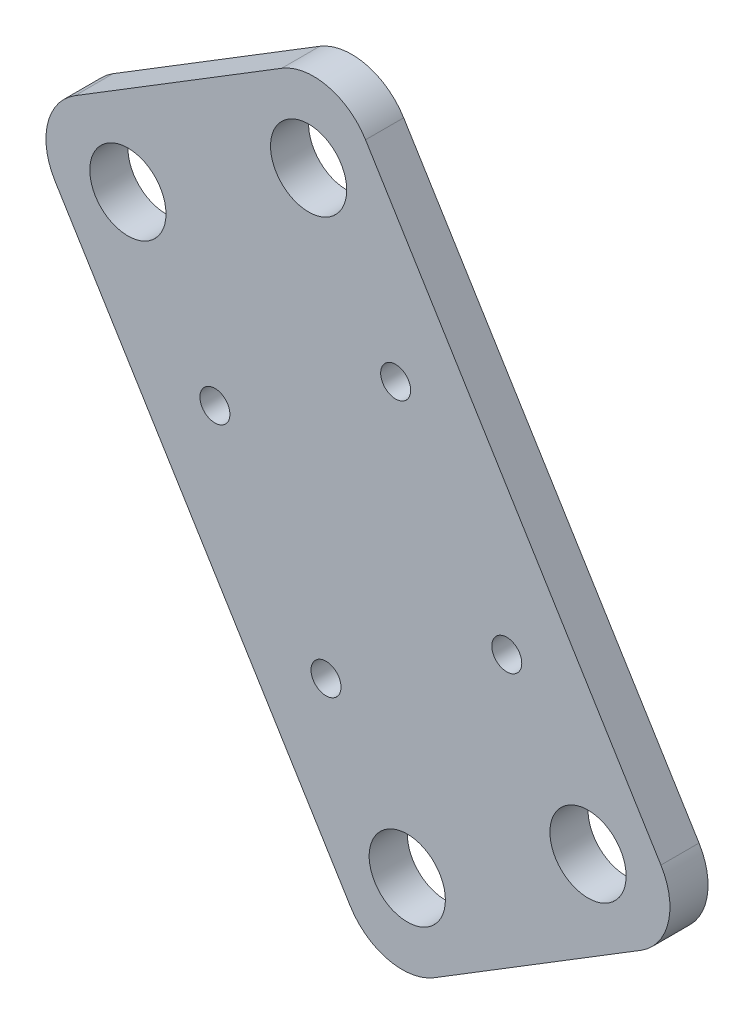
from build123d import *

# Parameters (mm, degrees)
SKETCH1_R           = 3.175
BOSS_EXTRUDE1_DEPTH = 3.175


with BuildPart() as part:
    # Sketch1 → Boss-Extrude1 (new body)
    with BuildSketch(Plane.XY):
        with BuildLine():
            Line((-86.435913995, -165.602360031), (-61.825632619, -205.632275727))
            ThreePointArc((-61.825632619, -205.632275727), (-58.676812327, -207.913058463), (-54.837503206, -207.299263221))
            Line((-54.837503206, -207.299263221), (-37.614442835, -196.710573375))
            ThreePointArc((-37.614442835, -196.710573375), (-35.333660099, -193.561753082), (-35.947455341, -189.722443962))
            Line((-35.947455341, -189.722443962), (-60.557736717, -149.692528266))
            ThreePointArc((-60.557736717, -149.692528266), (-63.706557009, -147.411745529), (-67.54586613, -148.025540772))
            Line((-67.54586613, -148.025540772), (-84.768926501, -158.614230618))
            ThreePointArc((-84.768926501, -158.614230618), (-87.049709237, -161.763050911), (-86.435913995, -165.602360031))
        make_face()
        with Locations((-80.361323188, -163.358535945)):
            Circle(SKETCH1_R, mode=Mode.SUBTRACT)
        with Locations((-65.302042044, -154.100131579)):
            Circle(SKETCH1_R, mode=Mode.SUBTRACT)
        with Locations((-42.022046148, -191.966268048)):
            Circle(SKETCH1_R, mode=Mode.SUBTRACT)
        with Locations((-57.081327292, -201.224672414)):
            Circle(SKETCH1_R, mode=Mode.SUBTRACT)
        with BuildLine():
            ThreePointArc((-62.635083896, -190.503539682), (-63.560924333, -188.997611568), (-65.066852447, -189.923452004))
            ThreePointArc((-65.066852447, -189.923452004), (-64.141012011, -191.429380119), (-62.635083896, -190.503539682))
        make_face(mode=Mode.SUBTRACT)
        with BuildLine():
            ThreePointArc((-50.007571303, -180.665047637), (-49.081730866, -182.170975752), (-47.575802752, -181.245135315))
            ThreePointArc((-47.575802752, -181.245135315), (-48.501643188, -179.739207201), (-50.007571303, -180.665047637))
        make_face(mode=Mode.SUBTRACT)
        with BuildLine():
            ThreePointArc((-56.834207119, -166.185854171), (-57.760047555, -164.679926057), (-59.26597567, -165.605766493))
            ThreePointArc((-59.26597567, -165.605766493), (-58.340135233, -167.111694608), (-56.834207119, -166.185854171))
        make_face(mode=Mode.SUBTRACT)
        with BuildLine():
            ThreePointArc((-74.325256814, -174.86417086), (-73.399416377, -176.370098974), (-71.893488263, -175.444258538))
            ThreePointArc((-71.893488263, -175.444258538), (-72.819328699, -173.938330423), (-74.325256814, -174.86417086))
        make_face(mode=Mode.SUBTRACT)
    extrude(amount=BOSS_EXTRUDE1_DEPTH)


solid = part.part
